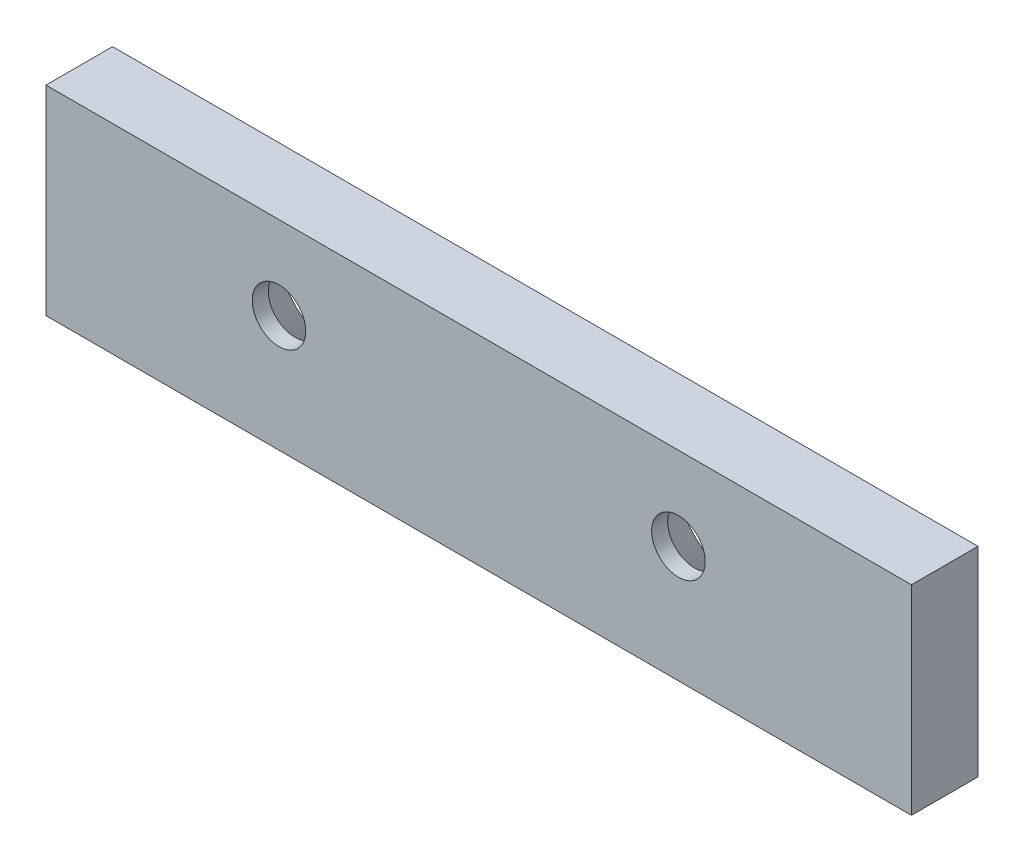
from build123d import *

# Parameters (mm, degrees)
SKETCH1_W                        = 82.55
SKETCH1_H                        = 19.05
BOSS_EXTRUDE1_DEPTH              = 6.35
F_1_4_20_TAPPED_HOLE1_AT_2_COUNT = 2
F_1_4_20_TAPPED_HOLE1_AT_2_PITCH = 38.1


with BuildPart() as part:
    # Sketch1 → Boss-Extrude1 (new body)
    with BuildSketch(Plane.XY):
        with Locations((41.275, 9.525)):
            Rectangle(SKETCH1_W, SKETCH1_H)
    extrude(amount=-BOSS_EXTRUDE1_DEPTH)

    # Sketch3 → 1/4-20 Tapped Hole1 (revolve, cut)
    with BuildSketch(Plane(origin=(22.225, 11.1125, 0), x_dir=(0, -1, 0), z_dir=(1, 0, 0))):
        Polygon((0, 0), (0, 6.35), (6.7437, 6.35), (2.5527, 1.528806005), (2.5527, 0), align=None)
    f_1_4_20_tapped_hole1 = revolve(axis=Axis((22.225, 11.1125, 6.35), (0, 0, -1)), mode=Mode.SUBTRACT)

    # 1/4-20 Tapped Hole1 at 2: 1/4-20 Tapped Hole1 ×2
    with Locations(*[(i * F_1_4_20_TAPPED_HOLE1_AT_2_PITCH, 0, 0) for i in range(1, F_1_4_20_TAPPED_HOLE1_AT_2_COUNT)]):
        add(f_1_4_20_tapped_hole1, mode=Mode.SUBTRACT)


solid = part.part
